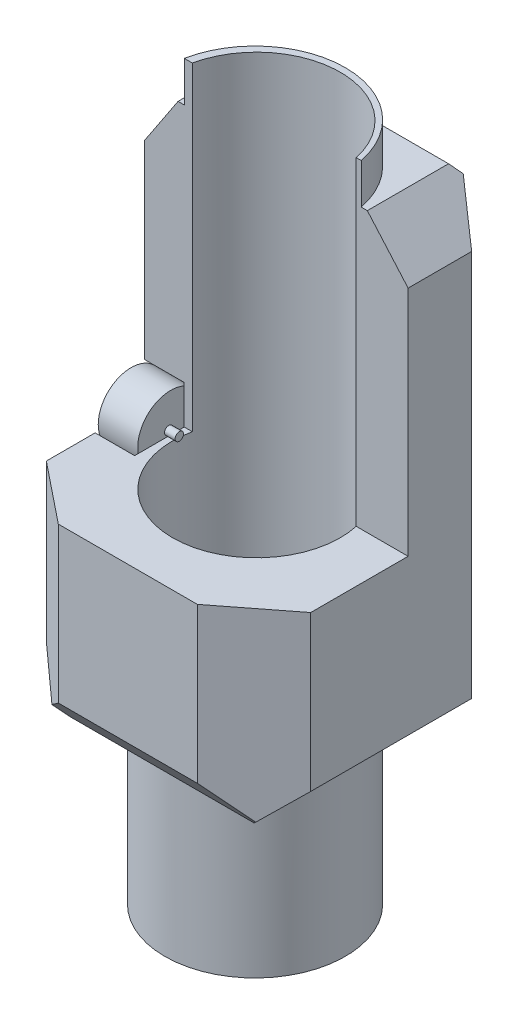
from build123d import *

# Parameters (mm, degrees)
SKETCH1_W           = 100
SKETCH1_H           = 100
BOSS_EXTRUDE1_DEPTH = 180
SKETCH2_R           = 34.257790197
BOSS_EXTRUDE2_DEPTH = 350
SKETCH3_W           = 152.006357392
SKETCH3_H           = 282.452416457
CUT_EXTRUDE2_DEPTH  = 400
CUT_EXTRUDE3_DEPTH  = 400
CUT_EXTRUDE4_DEPTH  = 400
CUT_EXTRUDE5_DEPTH  = 400
SKETCH7_W           = 160.159381639
SKETCH7_H           = 147.362276113
CUT_EXTRUDE6_DEPTH  = 400
SKETCH8_W           = 147.310744502
SKETCH8_H           = 162.038906966
CUT_EXTRUDE7_DEPTH  = 400
SKETCH9_R           = 31.847293423
CUT_EXTRUDE8_DEPTH  = 400
SKETCH10_W          = 140.220962397
SKETCH10_H          = 212.033531124
CUT_EXTRUDE9_DEPTH  = 400
SKETCH11_R          = 13.603137886
CUT_EXTRUDE11_DEPTH = 15
SKETCH12_R          = 12.495422516
BOSS_EXTRUDE3_DEPTH = 15
SKETCH13_R          = 1.594865099
BOSS_EXTRUDE4_DEPTH = 4
SKETCH14_W          = 100.74862993
SKETCH14_H          = 110.555003588
CUT_EXTRUDE13_DEPTH = 400


with BuildPart() as part:
    # Sketch1 → Boss-Extrude1 (new body)
    with BuildSketch(Plane(origin=(0, 0, 0), x_dir=(1, 0, 0), z_dir=(0, 1, 0))):
        with Locations((-50, 50)):
            Rectangle(SKETCH1_W, SKETCH1_H)
    extrude(amount=BOSS_EXTRUDE1_DEPTH)

    # Sketch2 → Boss-Extrude2 (add, symmetric)
    with BuildSketch(Plane(origin=(0, 180, 0), x_dir=(1, 0, 0), z_dir=(0, 1, 0))):
        with Locations(Location((-51.377291833, 49.076536384, 0), (0, 0, 270))):
            Circle(SKETCH2_R)
    extrude(amount=BOSS_EXTRUDE2_DEPTH, both=True)

    # Sketch3 → Cut-Extrude2 (cut)
    with BuildSketch(Plane(origin=(0, 0, 0), x_dir=(0, 0, -1), z_dir=(1, 0, 0))):
        with Locations((57.419900112, 502.274302507)):
            Rectangle(SKETCH3_W, SKETCH3_H)
    extrude(amount=-CUT_EXTRUDE2_DEPTH, mode=Mode.SUBTRACT)

    # Sketch4 → Cut-Extrude3 (cut)
    with BuildSketch(Plane(origin=(0, 0, 0), x_dir=(0, 0, -1), z_dir=(1, 0, 0))):
        Polygon((12.981970869, 0), (-8.994244796, 25.828096003), (-18.564506014, -15.259465835), align=None)
        Polygon((85.072517936, -1.448103984), (109.237639161, 19.113145112), (115.920034239, -3.267382694), align=None)
        Polygon((12.981970869, 180), (-8.994244796, 148.537596011), (-15.418178585, 193.219274892), align=None)
        Polygon((85.072517936, 181.854312784), (103.841225373, 159.795920888), (106.132549481, 198.647393934), align=None)
    extrude(amount=-CUT_EXTRUDE3_DEPTH, mode=Mode.SUBTRACT)

    # Sketch5 → Cut-Extrude4 (cut)
    with BuildSketch(Plane.XY):
        Polygon((-85.623287335, 0), (-106.370377984, 21.426392531), (-122.288861874, 3.209259887), (-93.526345261, -19.884701759), align=None)
        Polygon((-15.694988751, 0), (0, 15.257385304), (12.122677088, 15.257385304), (10.563067769, -19.884701759), align=None)
        Polygon((-87.166490339, 180.248071029), (-106.370377984, 151.29108453), (-117.705469457, 200.501115102), align=None)
        Polygon((-15.694988751, 180.248071029), (7.833767065, 153.279557508), (0, 193.941208308), align=None)
    extrude(amount=-CUT_EXTRUDE4_DEPTH, mode=Mode.SUBTRACT)

    # Sketch6 → Cut-Extrude5 (cut)
    with BuildSketch(Plane(origin=(0, 180, 0), x_dir=(1, 0, 0), z_dir=(0, 1, 0))):
        Polygon((-112.386997555, 28.400400964), (-64.261264503, -10.212759359), (-84.406366528, -15.51192827), (-124.649689542, -15.51192827), align=None)
        Polygon((-97.065537028, 135.861756084), (-119.37552445, 77.792688888), (-118.043343626, 64.347606737), (-66.428694172, 110.575168787), align=None)
        Polygon((-24.69640689, -21.815840769), (11.092108798, -8.97361337), (17.428316417, 32.393768119), (-38.531576846, -11.139157378), align=None)
        Polygon((-17.445484601, 140.804394854), (35.417473102, 107.262520599), (9.305452855, 72.996438725), (-31.724385352, 103.625272537), align=None)
    extrude(amount=-CUT_EXTRUDE5_DEPTH, mode=Mode.SUBTRACT)

    # Sketch7 → Cut-Extrude6 (cut)
    with BuildSketch(Plane.XY):
        with Locations((-66.123258915, -136.36252694)):
            Rectangle(SKETCH7_W, SKETCH7_H)
    extrude(amount=-CUT_EXTRUDE6_DEPTH, mode=Mode.SUBTRACT)

    # Sketch8 → Cut-Extrude7 (cut)
    with BuildSketch(Plane.XY):
        with Locations((-53.541153336, 332.448287589)):
            Rectangle(SKETCH8_W, SKETCH8_H)
    extrude(amount=-CUT_EXTRUDE7_DEPTH, mode=Mode.SUBTRACT)

    # Sketch9 → Cut-Extrude8 (cut)
    with BuildSketch(Plane(origin=(0, 251.428834106, 0), x_dir=(1, 0, 0), z_dir=(0, 1, 0))):
        with Locations(Location((-50.808993157, 49.032036374, 0), (0, 0, 270))):
            Circle(SKETCH9_R)
    extrude(amount=-CUT_EXTRUDE8_DEPTH, mode=Mode.SUBTRACT)

    # Sketch10 → Cut-Extrude9 (cut)
    with BuildSketch(Plane.ZY.offset(100)):
        with Locations((14.299084536, 180.100625535)):
            Rectangle(SKETCH10_W, SKETCH10_H)
    extrude(amount=-CUT_EXTRUDE9_DEPTH, mode=Mode.SUBTRACT)

    # Sketch11 → Cut-Extrude11 (cut)
    with BuildSketch(Plane.ZY.offset(100)):
        with Locations((-50.413251954, 76.264646142)):
            Circle(SKETCH11_R)
    extrude(amount=-CUT_EXTRUDE11_DEPTH, mode=Mode.SUBTRACT)

    # Sketch12 → Boss-Extrude3 (add)
    with BuildSketch(Plane.ZY.offset(85)):
        with Locations(Location((-50.658800768, 76.222522328, 0), (0, 0, 114.353089558))):
            Circle(SKETCH12_R)
    extrude(amount=BOSS_EXTRUDE3_DEPTH)

    # Sketch13 → Boss-Extrude4 (add)
    with BuildSketch(Plane(origin=(-85, 0, 0), x_dir=(0, 0, -1), z_dir=(1, 0, 0))):
        with Locations(Location((49.945205578, 75.944780088, 0), (0, 0, 180))):
            Circle(SKETCH13_R)
    extrude(amount=BOSS_EXTRUDE4_DEPTH)

    # Sketch14 → Cut-Extrude13 (cut)
    with BuildSketch(Plane.ZY.offset(100)):
        with Locations((-65.350029467, 250.603414818)):
            Rectangle(SKETCH14_W, SKETCH14_H)
    extrude(amount=-CUT_EXTRUDE13_DEPTH, mode=Mode.SUBTRACT)


solid = part.part
